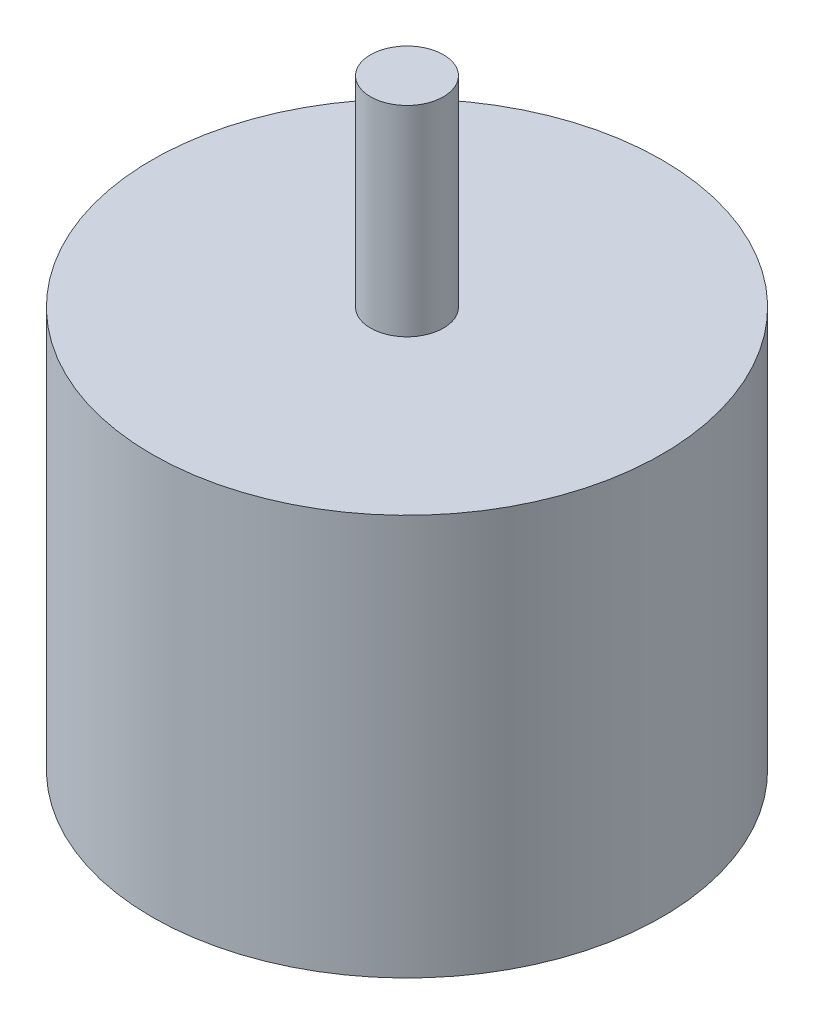
from build123d import *

# Parameters (mm, degrees)
SKETCH1_R           = 22.225
BOSS_EXTRUDE1_DEPTH = 34.925
SKETCH2_R           = 3.175
BOSS_EXTRUDE2_DEPTH = 17.4625


with BuildPart() as part:
    # Sketch1 → Boss-Extrude1 (new body)
    with BuildSketch(Plane(origin=(0, 0, 0), x_dir=(1, 0, 0), z_dir=(0, 1, 0))):
        with Locations(Location((0, 0, 0), (0, 0, 270))):
            Circle(SKETCH1_R)
    extrude(amount=BOSS_EXTRUDE1_DEPTH)

    # Sketch2 → Boss-Extrude2 (add)
    with BuildSketch(Plane(origin=(0, 34.925, 0), x_dir=(1, 0, 0), z_dir=(0, 1, 0))):
        with Locations(Location((0, 0, 0), (0, 0, 270))):
            Circle(SKETCH2_R)
    extrude(amount=BOSS_EXTRUDE2_DEPTH)


solid = part.part
